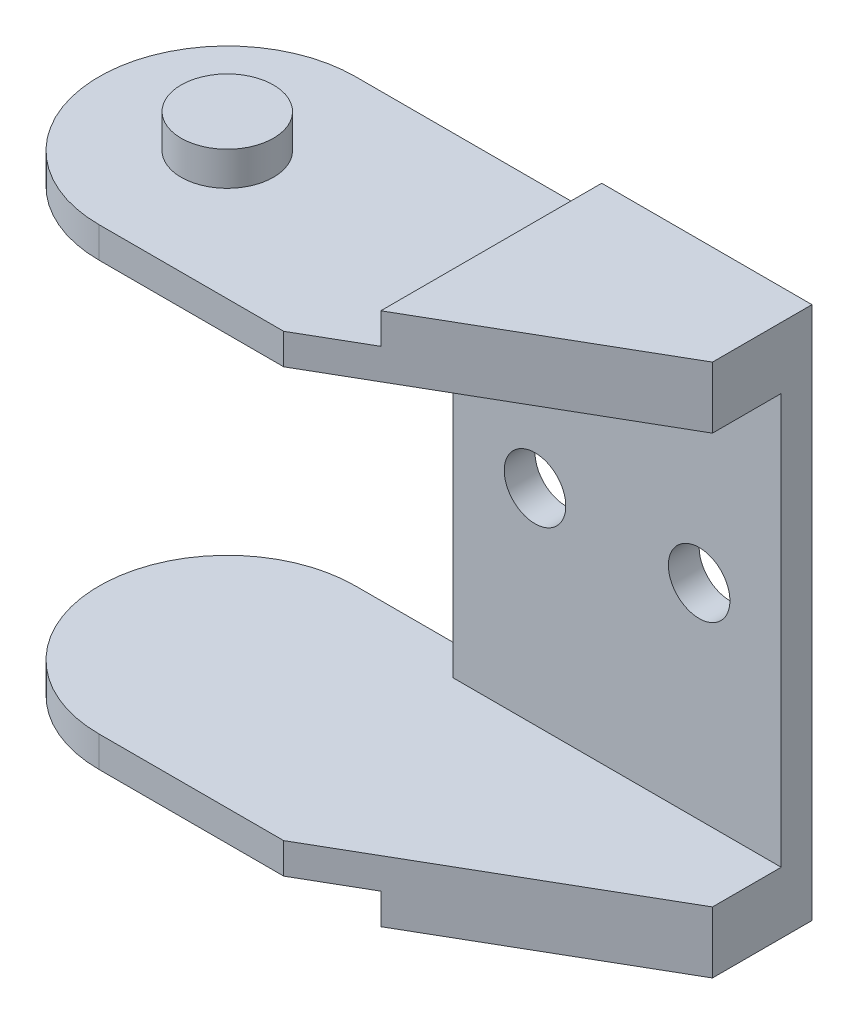
from build123d import *

# Parameters (mm, degrees)
BOSS_EXTRUDE1_DEPTH          = 13
CUT_EXTRUDE1_DEPTH           = 10
SKETCH3_W                    = 18.25
SKETCH3_H                    = 12.5
CUT_EXTRUDE2_DEPTH           = 1.5
SKETCH7_R                    = 2.25
BOSS_EXTRUDE2_DEPTH          = 1.65
F_3_0_3_DIAMETER_HOLE1_D     = 3
F_3_0_3_DIAMETER_HOLE1_DEPTH = 12.5


with BuildPart() as part:
    # Sketch1 → Boss-Extrude1 (new, symmetric)
    with BuildSketch(Plane(origin=(0, 0, 0), x_dir=(1, 0, 0), z_dir=(0, 1, 0))):
        with BuildLine():
            Line((9, -6.25), (22.25, 1.399891067))
            Line((22.25, 1.399891067), (22.25, 6.25))
            Line((22.25, 6.25), (0, 6.25))
            ThreePointArc((0, 6.25), (-6.25, 0), (0, -6.25))
            Line((0, -6.25), (9, -6.25))
        make_face()
    extrude(amount=BOSS_EXTRUDE1_DEPTH, both=True)

    # Sketch2 → Cut-Extrude1 (cut, symmetric)
    with BuildSketch(Plane(origin=(0, 0, 0), x_dir=(1, 0, 0), z_dir=(0, 1, 0))):
        Polygon((6.25, 4.75), (6.25, 6.25), (-6.25, 6.25), (-6.25, -6.25), (22.25, -6.25), (22.25, 4.75), align=None)
    extrude(amount=CUT_EXTRUDE1_DEPTH, both=True, mode=Mode.SUBTRACT)

    # Sketch3 → Cut-Extrude2 (cut)
    with BuildSketch(Plane(origin=(0, 13, 0), x_dir=(-1, 0, 0), z_dir=(0, 1, 0))):
        with Locations((-2.875, 0)):
            Rectangle(SKETCH3_W, SKETCH3_H)
    cut_extrude2 = extrude(amount=-CUT_EXTRUDE2_DEPTH, mode=Mode.SUBTRACT)

    # Mirror1: Cut-Extrude2 across plane
    add(cut_extrude2.mirror(Plane.ZX), mode=Mode.SUBTRACT)

    # Sketch7 → Boss-Extrude2 (add)
    with BuildSketch(Plane(origin=(0, 11.5, 0), x_dir=(-1, 0, 0), z_dir=(0, 1, 0))):
        with Locations(Location((0, 0, 0), (0, 0, 90))):
            Circle(SKETCH7_R)
    boss_extrude2 = extrude(amount=BOSS_EXTRUDE2_DEPTH)

    # Mirror2: Boss-Extrude2 across plane
    add(boss_extrude2.mirror(Plane.ZX))

    # Ø3.0 (3) Diameter Hole1
    with Locations(Plane(origin=(0, 0, -6.25), x_dir=(-1, 0, 0), z_dir=(0, 0, -1))):
        with Locations((-10.25, 0), (-18.25, 0)):
            Hole(F_3_0_3_DIAMETER_HOLE1_D / 2, depth=F_3_0_3_DIAMETER_HOLE1_DEPTH)


solid = part.part
